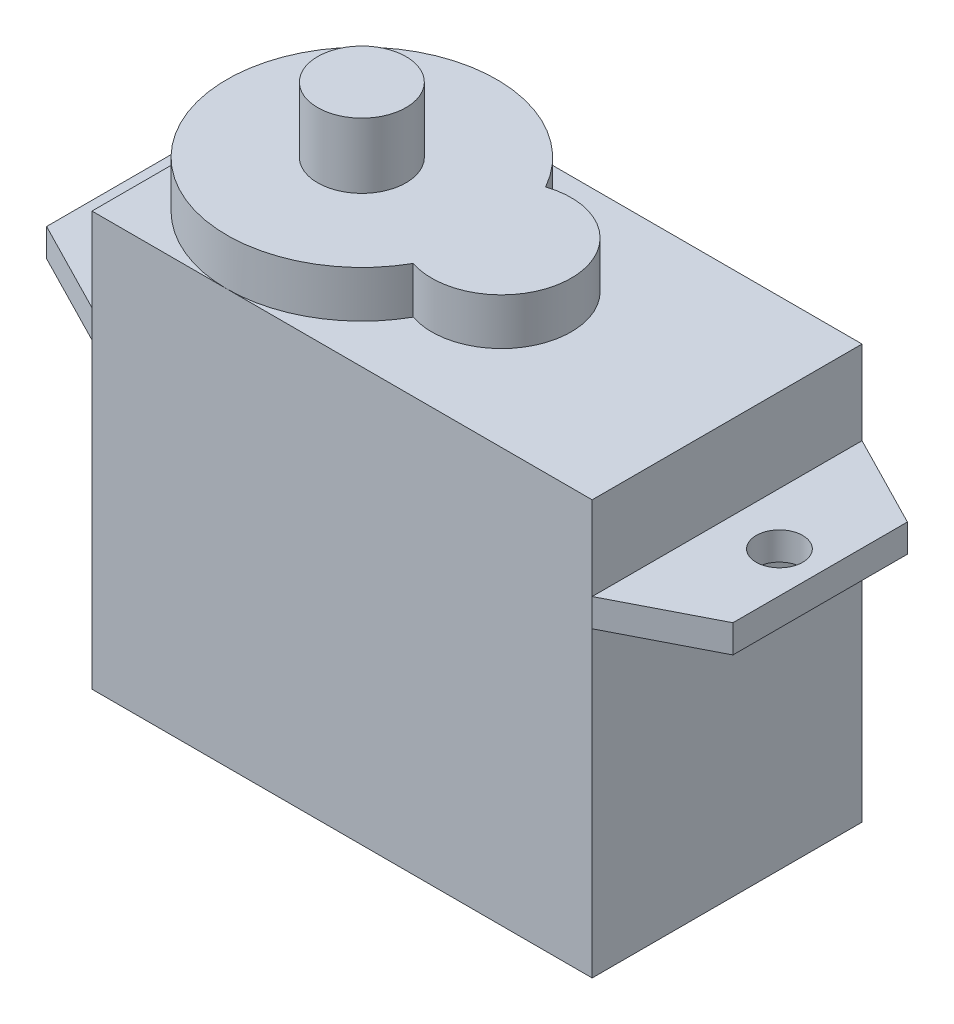
from build123d import *

# Parameters (mm, degrees)
SKETCH1_W           = 21.5
SKETCH1_H           = 11.6
BOSS_EXTRUDE1_DEPTH = 13
SKETCH2_R           = 1
BOSS_EXTRUDE2_DEPTH = 1.2
SKETCH3_W           = 21.5
SKETCH3_H           = 11.6
BOSS_EXTRUDE3_DEPTH = 3.6
BOSS_EXTRUDE4_DEPTH = 2
SKETCH5_R           = 1.9
BOSS_EXTRUDE5_DEPTH = 2.8


with BuildPart() as part:
    # Sketch1 → Boss-Extrude1 (new body)
    with BuildSketch(Plane(origin=(0, 0, 0), x_dir=(1, 0, 0), z_dir=(0, 1, 0))):
        Rectangle(SKETCH1_W, SKETCH1_H)
    extrude(amount=BOSS_EXTRUDE1_DEPTH)

    # Sketch2 → Boss-Extrude2 (add)
    with BuildSketch(Plane(origin=(0, 13, 0), x_dir=(1, 0, 0), z_dir=(0, 1, 0))):
        Polygon((-10.75, 5.8), (-14.75, 3.75), (-14.75, -3.75), (-10.75, -5.8), (10.75, -5.8), (14.75, -3.75), (14.75, 3.75), (10.75, 5.8), align=None)
        with Locations(Location((-13, 0, 0), (0, 0, 270))):
            Circle(SKETCH2_R, mode=Mode.SUBTRACT)
        with Locations(Location((13, 0, 0), (0, 0, 90))):
            Circle(SKETCH2_R, mode=Mode.SUBTRACT)
    extrude(amount=BOSS_EXTRUDE2_DEPTH)

    # Sketch3 → Boss-Extrude3 (add)
    with BuildSketch(Plane(origin=(0, 14.2, 0), x_dir=(1, 0, 0), z_dir=(0, 1, 0))):
        Rectangle(SKETCH3_W, SKETCH3_H)
    extrude(amount=BOSS_EXTRUDE3_DEPTH)

    # Sketch4 → Boss-Extrude4 (add)
    with BuildSketch(Plane(origin=(0, 17.8, 0), x_dir=(1, 0, 0), z_dir=(0, 1, 0))):
        with BuildLine():
            ThreePointArc((0.103333333, 2.846721311), (-10.75, 0), (0.103333333, -2.846721311))
            ThreePointArc((0.103333333, -2.846721311), (4.05, 0), (0.103333333, 2.846721311))
        make_face()
    extrude(amount=BOSS_EXTRUDE4_DEPTH)

    # Sketch5 → Boss-Extrude5 (add)
    with BuildSketch(Plane(origin=(0, 19.8, 0), x_dir=(1, 0, 0), z_dir=(0, 1, 0))):
        with Locations(Location((-4.95, 0, 0), (0, 0, 270))):
            Circle(SKETCH5_R)
    extrude(amount=BOSS_EXTRUDE5_DEPTH)


solid = part.part
